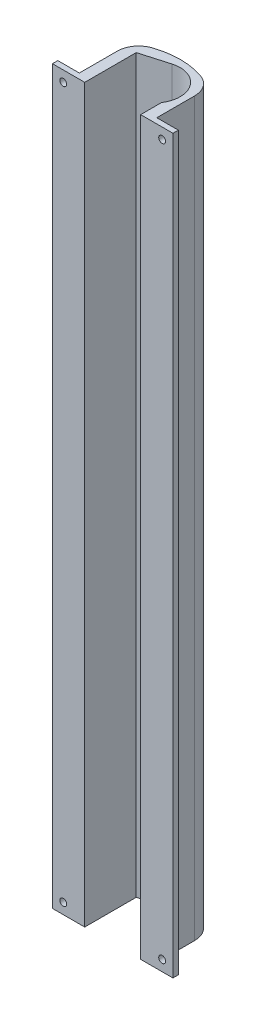
from build123d import *

# Parameters (mm, degrees)
BOSS_EXTRUDE1_DEPTH = 431.8
FILLET2_R           = 12.7
SKETCH2_R           = 2.032
CUT_EXTRUDE1_DEPTH  = 436.166892099


with BuildPart() as part:
    # Sketch1 → Boss-Extrude1 (new body)
    with BuildSketch(Plane(origin=(0, 0, 0), x_dir=(1, 0, 0), z_dir=(0, 1, 0))):
        with BuildLine():
            Line((12.446, -95.666893232), (12.446, -83.267976842))
            ThreePointArc((12.446, -83.267976842), (12.103082443, -66.082532596), (-4.162019583, -60.523437125))
            Line((-4.162019583, -60.523437125), (-20.574, -65.268050741))
            Line((-20.574, -65.268050741), (-20.574, -84.572180345))
            Line((-20.574, -84.572180345), (-20.574, -95.666893232))
            Line((-20.574, -95.666893232), (-39.624, -95.666893232))
            Line((-39.624, -95.666893232), (-39.624, -92.491893232))
            Line((-39.624, -92.491893232), (-26.924, -92.491893232))
            Line((-26.924, -92.491893232), (-26.924, -62.093050741))
            ThreePointArc((-26.924, -62.093050741), (-4.064, -55.764211531), (18.796, -62.093050741))
            Line((18.796, -62.093050741), (18.796, -92.491893232))
            Line((18.796, -92.491893232), (31.496, -92.491893232))
            Line((31.496, -92.491893232), (31.496, -95.666893232))
            Line((31.496, -95.666893232), (12.446, -95.666893232))
        make_face()
    extrude(amount=BOSS_EXTRUDE1_DEPTH)

    # Fillet2
    fillet2_edges = [part.edges().sort_by_distance(p)[0] for p in [
        (-26.924, 215.9, 62.093050741),
        (18.796, 215.9, 62.093050741),
    ]]
    fillet(fillet2_edges, radius=FILLET2_R)

    # Sketch2 → Cut-Extrude1 (cut, through all)
    with BuildSketch(Plane(origin=(0, 0, 92.491893232), x_dir=(-1, 0, 0), z_dir=(0, 0, -1))):
        with Locations((-25.146, 425.45)):
            Circle(SKETCH2_R)
        with Locations((-25.146, 6.35)):
            Circle(SKETCH2_R)
        with Locations((33.274, 425.45)):
            Circle(SKETCH2_R)
        with Locations((33.274, 6.35)):
            Circle(SKETCH2_R)
    extrude(amount=-CUT_EXTRUDE1_DEPTH, mode=Mode.SUBTRACT)


solid = part.part
